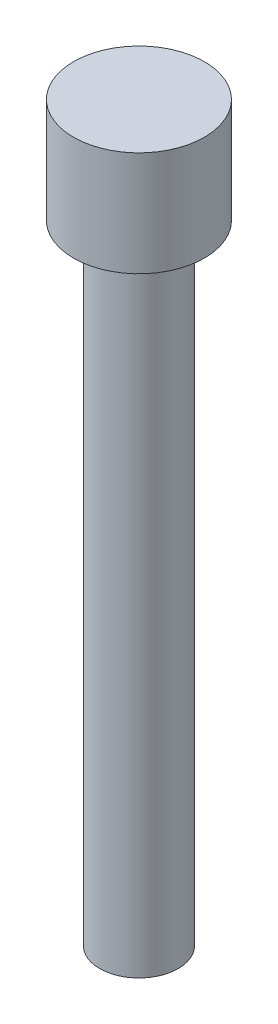
from build123d import *

# Parameters (mm, degrees)
SCHIZZO1_R                   = 1.5
ESTRUSIONE_ESTRUSIONE1_DEPTH = 24
SCHIZZO2_R                   = 2.5
ESTRUSIONE_ESTRUSIONE2_DEPTH = 4


with BuildPart() as part:
    # Schizzo1 → Estrusione-Estrusione1 (new body)
    with BuildSketch(Plane(origin=(0, 0, 0), x_dir=(1, 0, 0), z_dir=(0, 1, 0))):
        with Locations(Location((0, 0, 0), (0, 0, 270))):
            Circle(SCHIZZO1_R)
    extrude(amount=ESTRUSIONE_ESTRUSIONE1_DEPTH)

    # Schizzo2 → Estrusione-Estrusione2 (add)
    with BuildSketch(Plane(origin=(0, 24, 0), x_dir=(1, 0, 0), z_dir=(0, 1, 0))):
        with Locations(Location((0, 0, 0), (0, 0, 270))):
            Circle(SCHIZZO2_R)
    extrude(amount=ESTRUSIONE_ESTRUSIONE2_DEPTH)


solid = part.part
